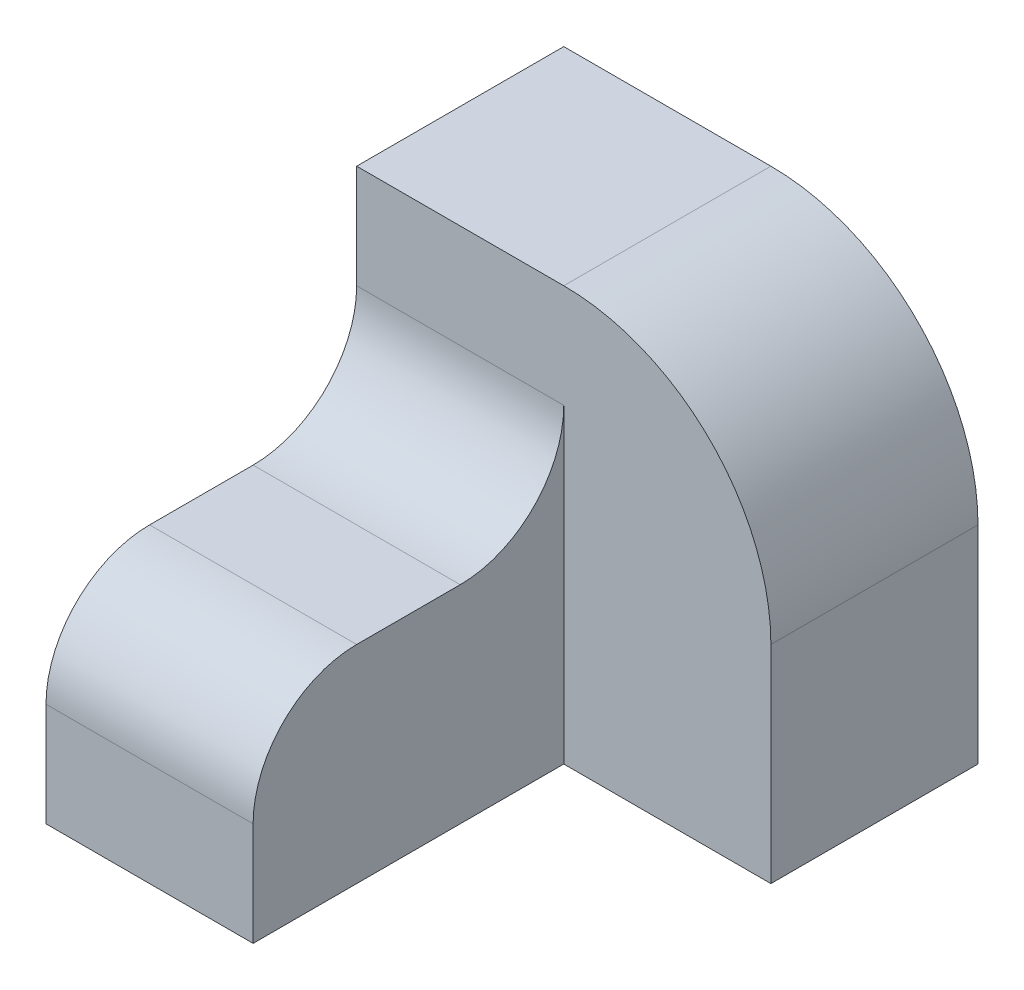
from build123d import *

# Parameters (mm, degrees)
SKETCH_1_W      = 20
SKETCH_1_H      = 10
EXTRUDE_1_DEPTH = 20
SKETCH_2_W      = 10
SKETCH_2_H      = 10
EXTRUDE_2_DEPTH = 15
FILLET_1_R      = 5
FILLET_2_R      = 10


with BuildPart() as part:
    # 草圖1 → 填料-伸長1 (new body)
    with BuildSketch(Plane(origin=(0, 0, 0), x_dir=(1, 0, 0), z_dir=(0, 1, 0))):
        with Locations((10, 5)):
            Rectangle(SKETCH_1_W, SKETCH_1_H)
    extrude(amount=EXTRUDE_1_DEPTH)

    # 草圖2 → 填料-伸長2 (add)
    with BuildSketch(Plane.XY):
        with Locations((5, 5)):
            Rectangle(SKETCH_2_W, SKETCH_2_H)
    extrude(amount=EXTRUDE_2_DEPTH)

    # 圓角1
    fillet_1_edges = [part.edges().sort_by_distance(p)[0] for p in [
        (5, 10, 0),
        (5, 10, 15),
    ]]
    fillet(fillet_1_edges, radius=FILLET_1_R)

    # 圓角2
    fillet_2_edges = [part.edges().sort_by_distance(p)[0] for p in [
        (20, 20, -5),
    ]]
    fillet(fillet_2_edges, radius=FILLET_2_R)


solid = part.part
